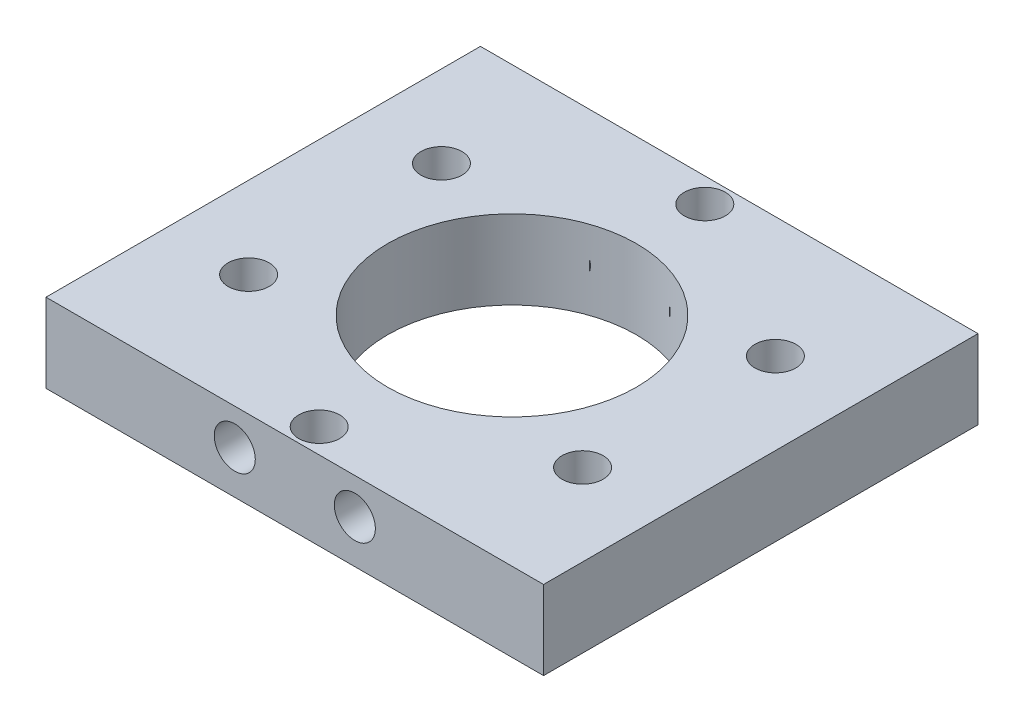
from build123d import *

# Parameters (mm, degrees)
SKETCH1_W           = 40
SKETCH1_H           = 6.35
BOSS_EXTRUDE1_DEPTH = 34.925
SKETCH2_R           = 1.651
CUT_EXTRUDE1_DEPTH  = 8
SKETCH3_R           = 10
CUT_EXTRUDE2_DEPTH  = 54.479698251
SKETCH4_R           = 1.65
CUT_EXTRUDE3_DEPTH  = 54.479698328
CIRPATTERN1_COUNT   = 6


with BuildPart() as part:
    # Sketch1 → Boss-Extrude1 (new body)
    with BuildSketch(Plane.XY):
        with Locations((20, 3.175)):
            Rectangle(SKETCH1_W, SKETCH1_H)
    extrude(amount=BOSS_EXTRUDE1_DEPTH)

    # Sketch2 → Cut-Extrude1 (cut)
    with BuildSketch(Plane.XY.offset(34.925)):
        with Locations((15.174, 3.472079932)):
            Circle(SKETCH2_R)
        with Locations((24.826, 3.472079932)):
            Circle(SKETCH2_R)
    cut_extrude1 = extrude(amount=-CUT_EXTRUDE1_DEPTH, mode=Mode.SUBTRACT)

    # Mirror1: Cut-Extrude1 across plane
    add(cut_extrude1.mirror(Plane.XY.offset(17.4625)), mode=Mode.SUBTRACT)

    # Sketch3 → Cut-Extrude2 (cut, through all)
    with BuildSketch(Plane(origin=(0, 6.35, 0), x_dir=(1, 0, 0), z_dir=(0, 1, 0))):
        with Locations(Location((20, -17.4625, 0), (0, 0, 270))):
            Circle(SKETCH3_R)
    extrude(amount=-CUT_EXTRUDE2_DEPTH, mode=Mode.SUBTRACT)

    # Sketch4 → Cut-Extrude3 (cut, through all)
    with BuildSketch(Plane(origin=(0, 6.35, 0), x_dir=(1, 0, 0), z_dir=(0, 1, 0))):
        with Locations(Location((20, -1.9625, 0), (0, 0, 270))):
            Circle(SKETCH4_R)
    cut_extrude3 = extrude(amount=-CUT_EXTRUDE3_DEPTH, mode=Mode.SUBTRACT)

    # CirPattern1: Cut-Extrude3 ×6 about axis
    cirpattern1_axis = Axis((20, 0, 17.4625), (0, 1, 0))
    for i in range(1, CIRPATTERN1_COUNT):
        add(cut_extrude3.rotate(cirpattern1_axis, i * 360 / CIRPATTERN1_COUNT), mode=Mode.SUBTRACT)


solid = part.part
